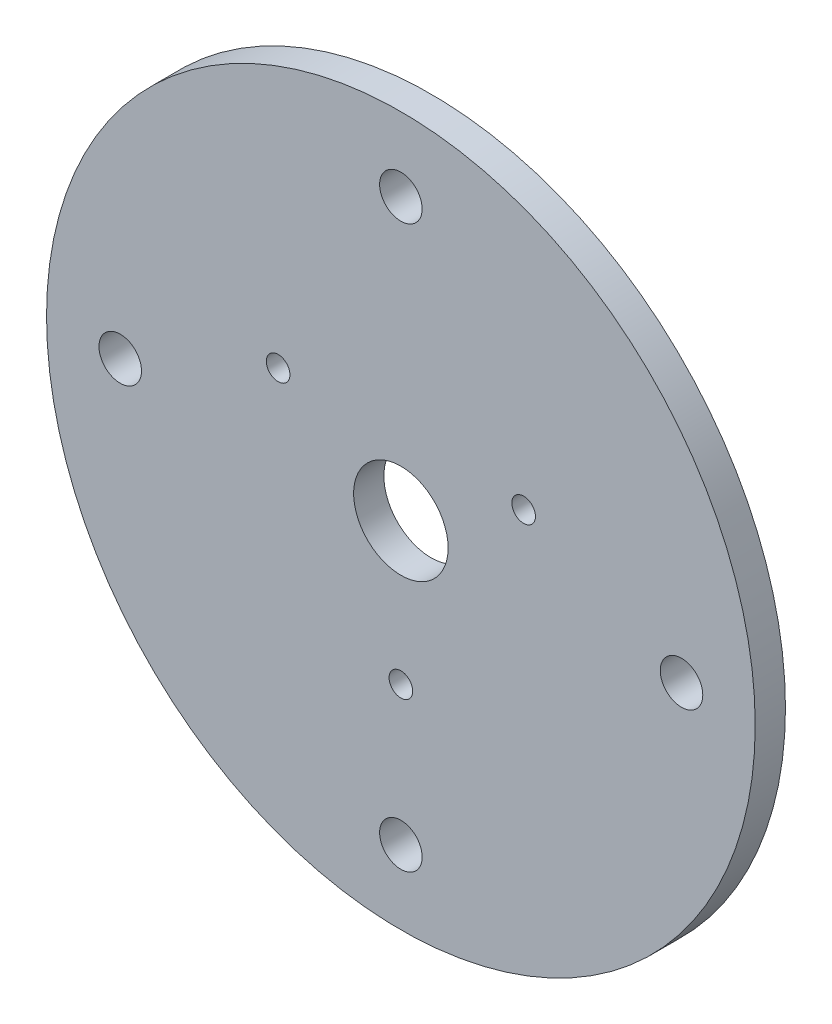
from build123d import *

# Parameters (mm, degrees)
SKETCH1_R           = 37.5
SKETCH1_R_2         = 2.25
SKETCH1_R_3         = 5
SKETCH1_R_4         = 1.25
BOSS_EXTRUDE1_DEPTH = 3.2


with BuildPart() as part:
    # Sketch1 → Boss-Extrude1 (new body)
    with BuildSketch(Plane.XY):
        Circle(SKETCH1_R)
        with Locations((0, 29.7)):
            Circle(SKETCH1_R_2, mode=Mode.SUBTRACT)
        Circle(SKETCH1_R_3, mode=Mode.SUBTRACT)
        with Locations((29.7, 0)):
            Circle(SKETCH1_R_2, mode=Mode.SUBTRACT)
        with Locations((0, -29.7)):
            Circle(SKETCH1_R_2, mode=Mode.SUBTRACT)
        with Locations((-29.7, 0)):
            Circle(SKETCH1_R_2, mode=Mode.SUBTRACT)
        with Locations((-12.990381057, 7.5)):
            Circle(SKETCH1_R_4, mode=Mode.SUBTRACT)
        with Locations((12.990381057, 7.5)):
            Circle(SKETCH1_R_4, mode=Mode.SUBTRACT)
        with Locations((0, -15)):
            Circle(SKETCH1_R_4, mode=Mode.SUBTRACT)
    extrude(amount=BOSS_EXTRUDE1_DEPTH)


solid = part.part
